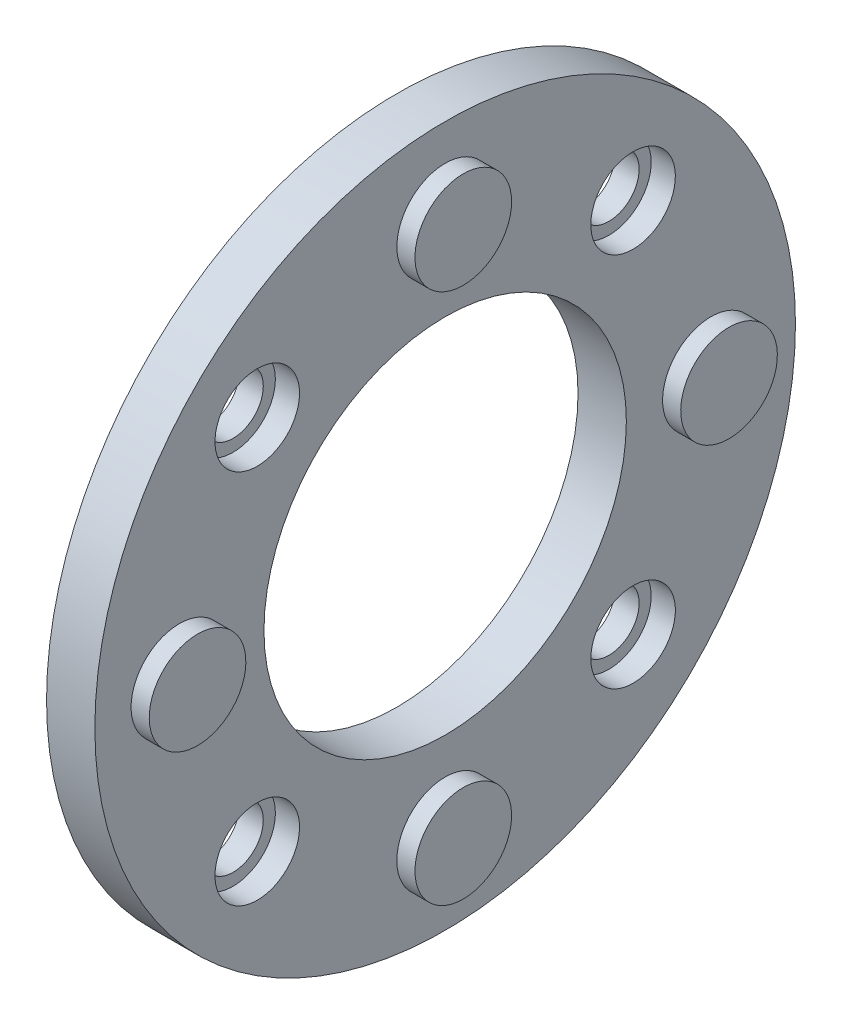
from build123d import *

# Parameters (mm, degrees)
SKETCH_1_R               = 29
EXTRUDE_1_DEPTH          = 4
CUT_EXTRUDE_1_DEPTH      = 42.206795556
CUT_EXTRUDE_1_DEPTH_BACK = 42.206795556
SKETCH_2_R               = 15
EXTRUDE_START            = -5
SKETCH_4_R               = 4
EXTRUDE_3_DEPTH          = 6.5
PATTERN_CIRCULAR_1_COUNT = 4
SKETCH_5_R               = 2.5
CUT_EXTRUDE_2_DEPTH      = 4.5
PATTERN_CIRCULAR_2_COUNT = 4
SKETCH_7_R               = 2.5
CUT_EXTRUDE_3_DEPTH      = 42.31585652
SKETCH_8_R               = 3.5
CUT_EXTRUDE_4_DEPTH      = 2
PATTERN_CIRCULAR_3_COUNT = 4


with BuildPart() as part:
    # 草图1 → 凸台-拉伸1 (new body)
    with BuildSketch(Plane(origin=(0, 0, 0), x_dir=(0, 0, -1), z_dir=(1, 0, 0))):
        Circle(SKETCH_1_R)
    extrude(amount=EXTRUDE_1_DEPTH)

    # 草图2 → 切除-拉伸1 (cut, two sides: drawn at the far end of the back side and taken through both)
    with BuildSketch(Plane(origin=(4, 0, 0), x_dir=(0, 0, -1), z_dir=(1, 0, 0)).offset(-CUT_EXTRUDE_1_DEPTH_BACK)):
        Circle(SKETCH_2_R)
    extrude(amount=CUT_EXTRUDE_1_DEPTH + CUT_EXTRUDE_1_DEPTH_BACK, mode=Mode.SUBTRACT)

    # 草图4 → 凸台-拉伸3 (add)
    with BuildSketch(Plane(origin=(4, 0, 0), x_dir=(0, 0, -1), z_dir=(1, 0, 0)).offset(EXTRUDE_START)):
        with Locations((0, 22)):
            Circle(SKETCH_4_R)
    extrude_3 = extrude(amount=EXTRUDE_3_DEPTH)

    # 阵列(圆周)1: 凸台-拉伸3 ×4 about axis
    pattern_circular_1_axis = Axis((0, 0, 0), (1, 0, 0))
    for i in range(1, PATTERN_CIRCULAR_1_COUNT):
        add(extrude_3.rotate(pattern_circular_1_axis, i * 360 / PATTERN_CIRCULAR_1_COUNT))

    # 草图5 → 切除-拉伸2 (cut)
    with BuildSketch(Plane.ZY.offset(1)):
        with Locations((0, 22)):
            Circle(SKETCH_5_R)
    cut_extrude_2 = extrude(amount=-CUT_EXTRUDE_2_DEPTH, mode=Mode.SUBTRACT)

    # 阵列(圆周)2: 切除-拉伸2 ×4 about axis
    pattern_circular_2_axis = Axis((0, 0, 0), (1, 0, 0))
    for i in range(1, PATTERN_CIRCULAR_2_COUNT):
        add(cut_extrude_2.rotate(pattern_circular_2_axis, i * 360 / PATTERN_CIRCULAR_2_COUNT), mode=Mode.SUBTRACT)

    # 草图7 → 切除-拉伸3 (cut, through all)
    with BuildSketch(Plane(origin=(4, 0, 0), x_dir=(0, 0, -1), z_dir=(1, 0, 0))):
        with Locations((-15.556349186, 15.556349186)):
            Circle(SKETCH_7_R)
    cut_extrude_3 = extrude(amount=-CUT_EXTRUDE_3_DEPTH, mode=Mode.SUBTRACT)

    # 草图8 → 切除-拉伸4 (cut)
    with BuildSketch(Plane(origin=(4, 0, 0), x_dir=(0, 0, -1), z_dir=(1, 0, 0))):
        with Locations((-15.556349186, 15.556349186)):
            Circle(SKETCH_8_R)
    cut_extrude_4 = extrude(amount=-CUT_EXTRUDE_4_DEPTH, mode=Mode.SUBTRACT)

    # 阵列(圆周)3: 切除-拉伸3, 切除-拉伸4 ×4 about axis
    pattern_circular_3_axis = Axis((0, 0, 0), (1, 0, 0))
    add([cut_extrude_3.rotate(pattern_circular_3_axis, i * 360 / PATTERN_CIRCULAR_3_COUNT) for i in range(1, PATTERN_CIRCULAR_3_COUNT)], mode=Mode.SUBTRACT)
    add([cut_extrude_4.rotate(pattern_circular_3_axis, i * 360 / PATTERN_CIRCULAR_3_COUNT) for i in range(1, PATTERN_CIRCULAR_3_COUNT)], mode=Mode.SUBTRACT)


solid = part.part
